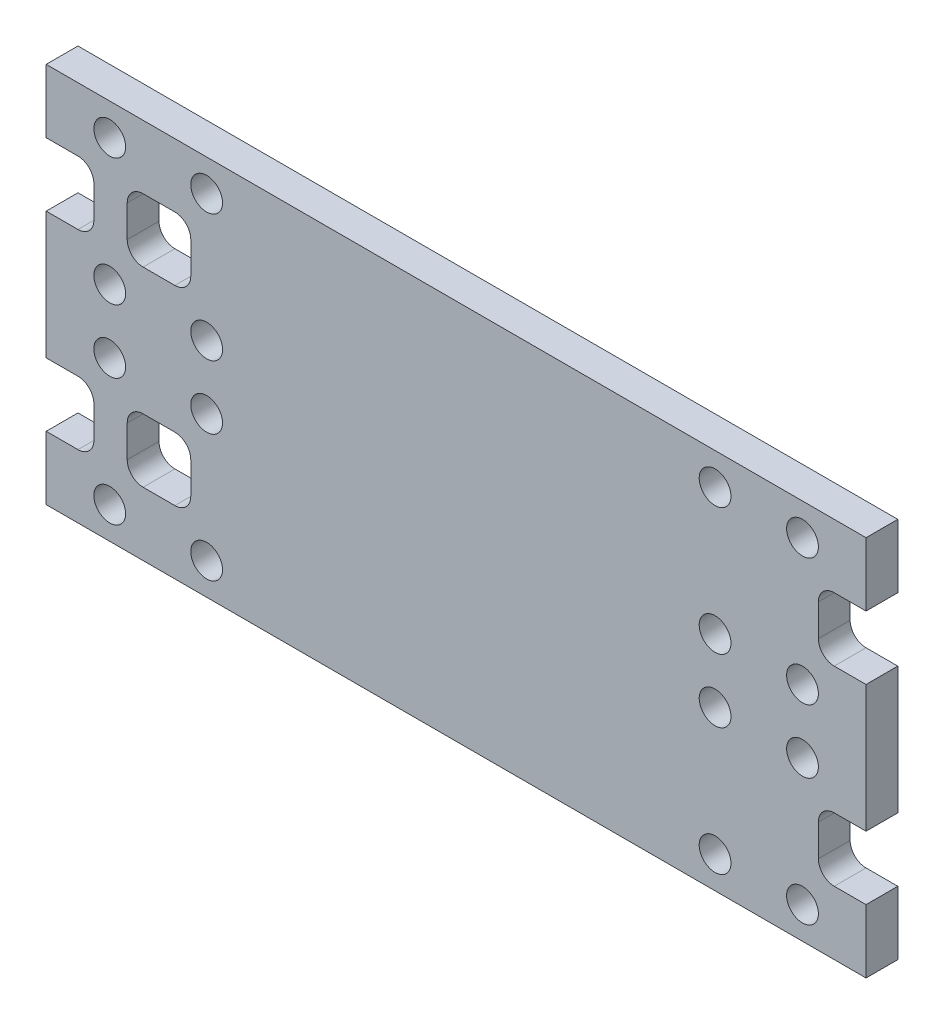
from build123d import *

# Parameters (mm, degrees)
SKETCH_14_R     = 1
EXTRUDE_1_DEPTH = 2


with BuildPart() as part:
    # 草圖14 → 填料-伸長1 (new body)
    with BuildSketch(Plane.XY):
        with BuildLine():
            Line((-33.721403204, -5), (-33.721403204, -7))
            ThreePointArc((-33.721403204, -7), (-34.014296423, -7.707106781), (-34.721403204, -8))
            Line((-34.721403204, -8), (-36.721403204, -8))
            Line((-36.721403204, -8), (-36.721403204, -16))
            Line((-36.721403204, -16), (-34.721403204, -16))
            ThreePointArc((-34.721403204, -16), (-34.014296423, -16.292893219), (-33.721403204, -17))
            Line((-33.721403204, -17), (-33.721403204, -19))
            ThreePointArc((-33.721403204, -19), (-34.014296423, -19.707106781), (-34.721403204, -20))
            Line((-34.721403204, -20), (-36.721403204, -20))
            Line((-36.721403204, -20), (-36.721403204, -24))
            Line((-36.721403204, -24), (14.878596796, -24))
            Line((14.878596796, -24), (14.878596796, -20))
            Line((14.878596796, -20), (12.878596796, -20))
            ThreePointArc((12.878596796, -20), (12.171490014, -19.707106781), (11.878596796, -19))
            Line((11.878596796, -19), (11.878596796, -17))
            ThreePointArc((11.878596796, -17), (12.171490014, -16.292893219), (12.878596796, -16))
            Line((12.878596796, -16), (14.878596796, -16))
            Line((14.878596796, -16), (14.878596796, -8))
            Line((14.878596796, -8), (12.878596796, -8))
            ThreePointArc((12.878596796, -8), (12.171490014, -7.707106781), (11.878596796, -7))
            Line((11.878596796, -7), (11.878596796, -5))
            ThreePointArc((11.878596796, -5), (12.171490014, -4.292893219), (12.878596796, -4))
            Line((12.878596796, -4), (14.878596796, -4))
            Line((14.878596796, -4), (14.878596796, 0))
            Line((14.878596796, 0), (-36.721403204, 0))
            Line((-36.721403204, 0), (-36.721403204, -4))
            Line((-36.721403204, -4), (-34.721403204, -4))
            ThreePointArc((-34.721403204, -4), (-34.014296423, -4.292893219), (-33.721403204, -5))
        make_face()
        with Locations((10.878596796, -14)):
            Circle(SKETCH_14_R, mode=Mode.SUBTRACT)
        with Locations((5.378124186, -14)):
            Circle(SKETCH_14_R, mode=Mode.SUBTRACT)
        with Locations((5.378124186, -22)):
            Circle(SKETCH_14_R, mode=Mode.SUBTRACT)
        with Locations((10.878596796, -22)):
            Circle(SKETCH_14_R, mode=Mode.SUBTRACT)
        with Locations((-26.621875814, -14)):
            Circle(SKETCH_14_R, mode=Mode.SUBTRACT)
        with Locations((-32.721875814, -14)):
            Circle(SKETCH_14_R, mode=Mode.SUBTRACT)
        with Locations((-32.721875814, -22)):
            Circle(SKETCH_14_R, mode=Mode.SUBTRACT)
        with Locations((-26.621875814, -22)):
            Circle(SKETCH_14_R, mode=Mode.SUBTRACT)
        with Locations((5.378124186, -2)):
            Circle(SKETCH_14_R, mode=Mode.SUBTRACT)
        with Locations((5.378124186, -10)):
            Circle(SKETCH_14_R, mode=Mode.SUBTRACT)
        with Locations((10.878596796, -10)):
            Circle(SKETCH_14_R, mode=Mode.SUBTRACT)
        with Locations((-32.721403204, -2)):
            Circle(SKETCH_14_R, mode=Mode.SUBTRACT)
        with Locations((-26.621875814, -2)):
            Circle(SKETCH_14_R, mode=Mode.SUBTRACT)
        with Locations((-32.721403204, -10)):
            Circle(SKETCH_14_R, mode=Mode.SUBTRACT)
        with Locations((-26.621875814, -10)):
            Circle(SKETCH_14_R, mode=Mode.SUBTRACT)
        with Locations((10.878596796, -2)):
            Circle(SKETCH_14_R, mode=Mode.SUBTRACT)
        with BuildLine():
            Line((-30.621875814, -4), (-28.621875814, -4))
            ThreePointArc((-28.621875814, -4), (-27.914769033, -4.292893219), (-27.621875814, -5))
            Line((-27.621875814, -5), (-27.621875814, -7))
            ThreePointArc((-27.621875814, -7), (-27.914769033, -7.707106781), (-28.621875814, -8))
            Line((-28.621875814, -8), (-30.621875814, -8))
            ThreePointArc((-30.621875814, -8), (-31.328982596, -7.707106781), (-31.621875814, -7))
            Line((-31.621875814, -7), (-31.621875814, -5))
            ThreePointArc((-31.621875814, -5), (-31.328982596, -4.292893219), (-30.621875814, -4))
        make_face(mode=Mode.SUBTRACT)
        with BuildLine():
            Line((-27.621875814, -17), (-27.621875814, -19))
            ThreePointArc((-27.621875814, -19), (-27.914769033, -19.707106781), (-28.621875814, -20))
            Line((-28.621875814, -20), (-30.621875814, -20))
            ThreePointArc((-30.621875814, -20), (-31.328982596, -19.707106781), (-31.621875814, -19))
            Line((-31.621875814, -19), (-31.621875814, -17))
            ThreePointArc((-31.621875814, -17), (-31.328982596, -16.292893219), (-30.621875814, -16))
            Line((-30.621875814, -16), (-28.621875814, -16))
            ThreePointArc((-28.621875814, -16), (-27.914769033, -16.292893219), (-27.621875814, -17))
        make_face(mode=Mode.SUBTRACT)
    extrude(amount=EXTRUDE_1_DEPTH)


solid = part.part
